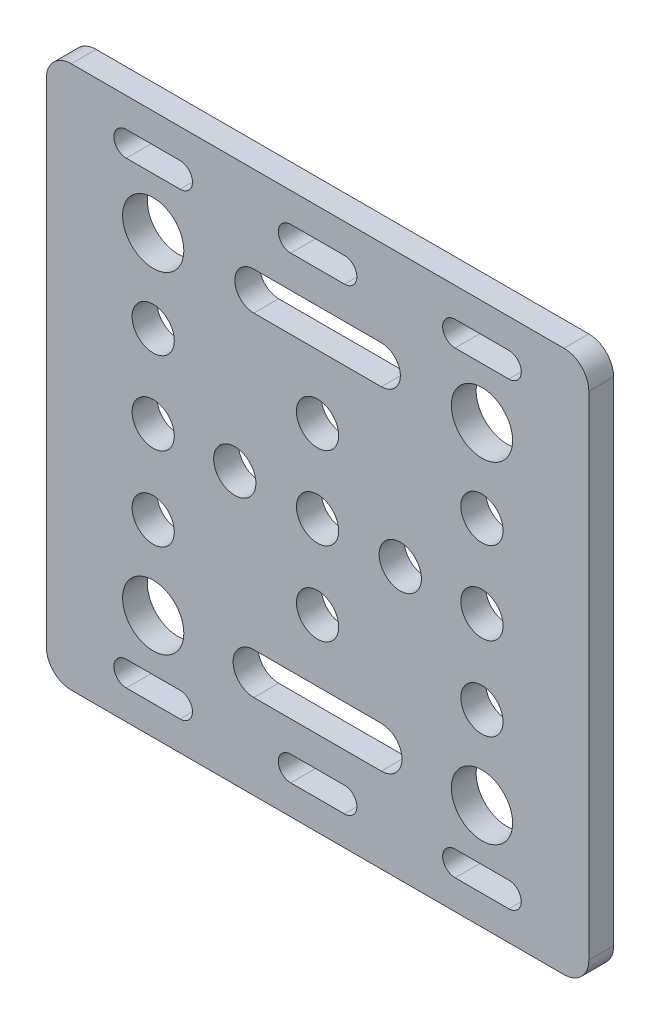
from build123d import *

# Parameters (mm, degrees)
ESQUISSE1_R        = 2.55
ESQUISSE1_R_2      = 3.7
BOSS_EXTRU_1_DEPTH = 3


with BuildPart() as part:
    # Esquisse1 → Boss.-Extru.1 (new body)
    with BuildSketch(Plane.XY):
        with BuildLine():
            Line((101.976699249, 347.427119348), (161.476699249, 347.427119348))
            ThreePointArc((161.476699249, 347.427119348), (163.598019592, 346.548439691), (164.476699249, 344.427119348))
            Line((164.476699249, 344.427119348), (164.476699249, 284.927119348))
            ThreePointArc((164.476699249, 284.927119348), (163.598019592, 282.805799004), (161.476699249, 281.927119348))
            Line((161.476699249, 281.927119348), (101.976699249, 281.927119348))
            ThreePointArc((101.976699249, 281.927119348), (99.855378905, 282.805799004), (98.976699249, 284.927119348))
            Line((98.976699249, 284.927119348), (98.976699249, 344.427119348))
            ThreePointArc((98.976699249, 344.427119348), (99.855378905, 346.548439691), (101.976699249, 347.427119348))
        make_face()
        with Locations((111.877106564, 324.67963586)):
            Circle(ESQUISSE1_R, mode=Mode.SUBTRACT)
        with Locations((131.724446066, 324.67963586)):
            Circle(ESQUISSE1_R, mode=Mode.SUBTRACT)
        with Locations((151.573607548, 324.67963586)):
            Circle(ESQUISSE1_R, mode=Mode.SUBTRACT)
        with Locations((111.876699249, 314.71581075)):
            Circle(ESQUISSE1_R, mode=Mode.SUBTRACT)
        with Locations((131.724446066, 314.71581075)):
            Circle(ESQUISSE1_R, mode=Mode.SUBTRACT)
        with Locations((151.573607548, 314.71581075)):
            Circle(ESQUISSE1_R, mode=Mode.SUBTRACT)
        with Locations((121.727110154, 314.71581075)):
            Circle(ESQUISSE1_R, mode=Mode.SUBTRACT)
        with Locations((141.711298303, 314.71581075)):
            Circle(ESQUISSE1_R, mode=Mode.SUBTRACT)
        with Locations((111.876699249, 304.673954232)):
            Circle(ESQUISSE1_R, mode=Mode.SUBTRACT)
        with Locations((131.724446066, 304.673954232)):
            Circle(ESQUISSE1_R, mode=Mode.SUBTRACT)
        with Locations((151.573607548, 304.673954232)):
            Circle(ESQUISSE1_R, mode=Mode.SUBTRACT)
        with Locations((111.876699249, 334.675400392)):
            Circle(ESQUISSE1_R_2, mode=Mode.SUBTRACT)
        with Locations((151.576699249, 334.675400392)):
            Circle(ESQUISSE1_R_2, mode=Mode.SUBTRACT)
        with Locations((111.876699249, 294.677119348)):
            Circle(ESQUISSE1_R_2, mode=Mode.SUBTRACT)
        with Locations((151.576699249, 294.677119348)):
            Circle(ESQUISSE1_R_2, mode=Mode.SUBTRACT)
        with BuildLine():
            Line((108.630480955, 343.876892887), (115.122917543, 343.876892887))
            ThreePointArc((115.122917543, 343.876892887), (116.622917543, 342.376892887), (115.122917543, 340.876892887))
            Line((115.122917543, 340.876892887), (108.630480955, 340.876892887))
            ThreePointArc((108.630480955, 340.876892887), (107.130480955, 342.376892887), (108.630480955, 343.876892887))
        make_face(mode=Mode.SUBTRACT)
        with BuildLine():
            Line((128.480480955, 343.876892887), (134.972917543, 343.876892887))
            ThreePointArc((134.972917543, 343.876892887), (136.472917543, 342.376892887), (134.972917543, 340.876892887))
            Line((134.972917543, 340.876892887), (128.480480955, 340.876892887))
            ThreePointArc((128.480480955, 340.876892887), (126.980480955, 342.376892887), (128.480480955, 343.876892887))
        make_face(mode=Mode.SUBTRACT)
        with BuildLine():
            Line((148.330480955, 343.876892887), (154.822917543, 343.876892887))
            ThreePointArc((154.822917543, 343.876892887), (156.322917543, 342.376892887), (154.822917543, 340.876892887))
            Line((154.822917543, 340.876892887), (148.330480955, 340.876892887))
            ThreePointArc((148.330480955, 340.876892887), (146.830480955, 342.376892887), (148.330480955, 343.876892887))
        make_face(mode=Mode.SUBTRACT)
        with BuildLine():
            Line((108.630480955, 288.481388741), (115.122917543, 288.481388741))
            ThreePointArc((115.122917543, 288.481388741), (116.622917543, 286.981388741), (115.122917543, 285.481388741))
            Line((115.122917543, 285.481388741), (108.630480955, 285.481388741))
            ThreePointArc((108.630480955, 285.481388741), (107.130480955, 286.981388741), (108.630480955, 288.481388741))
        make_face(mode=Mode.SUBTRACT)
        with BuildLine():
            Line((128.480480955, 288.481388741), (134.972917543, 288.481388741))
            ThreePointArc((134.972917543, 288.481388741), (136.472917543, 286.981388741), (134.972917543, 285.481388741))
            Line((134.972917543, 285.481388741), (128.480480955, 285.481388741))
            ThreePointArc((128.480480955, 285.481388741), (126.980480955, 286.981388741), (128.480480955, 288.481388741))
        make_face(mode=Mode.SUBTRACT)
        with BuildLine():
            Line((148.330480955, 288.481388741), (154.822917543, 288.481388741))
            ThreePointArc((154.822917543, 288.481388741), (156.322917543, 286.981388741), (154.822917543, 285.481388741))
            Line((154.822917543, 285.481388741), (148.330480955, 285.481388741))
            ThreePointArc((148.330480955, 285.481388741), (146.830480955, 286.981388741), (148.330480955, 288.481388741))
        make_face(mode=Mode.SUBTRACT)
        with BuildLine():
            Line((124.031761784, 336.975400392), (139.421636714, 336.975400392))
            ThreePointArc((139.421636714, 336.975400392), (141.721636714, 334.675400392), (139.421636714, 332.375400392))
            Line((139.421636714, 332.375400392), (124.031761784, 332.375400392))
            ThreePointArc((124.031761784, 332.375400392), (121.731761784, 334.675400392), (124.031761784, 336.975400392))
        make_face(mode=Mode.SUBTRACT)
        with BuildLine():
            Line((124.031761784, 297.177119348), (139.421636714, 297.177119348))
            ThreePointArc((139.421636714, 297.177119348), (141.921636714, 294.677119348), (139.421636714, 292.177119348))
            Line((139.421636714, 292.177119348), (124.031761784, 292.177119348))
            ThreePointArc((124.031761784, 292.177119348), (121.531761784, 294.677119348), (124.031761784, 297.177119348))
        make_face(mode=Mode.SUBTRACT)
    extrude(amount=BOSS_EXTRU_1_DEPTH)


solid = part.part
